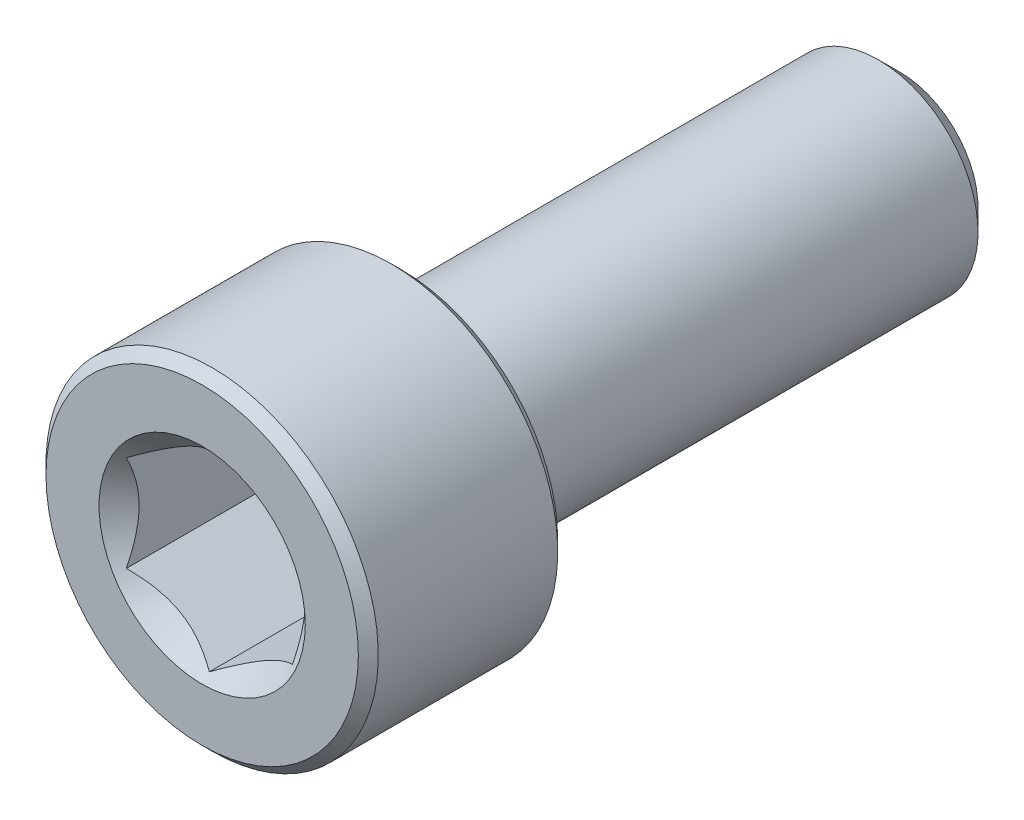
from build123d import *

# Parameters (mm, degrees)
CUT_EXTRUDE1_DEPTH = 5
SKETCH4_R          = 3.103257697
CUT_EXTRUDE2_DEPTH = 3
CUT_EXTRUDE2_DRAFT = -45


with BuildPart() as part:
    # Sketch2 → Revolve1 (revolve)
    with BuildSketch(Plane(origin=(0, 0, 0), x_dir=(0, 0, -1), z_dir=(1, 0, 0))):
        with BuildLine():
            Line((-10.5, 0), (-10.5, 4.7))
            Line((-10.5, 4.7), (-10.2, 5))
            Line((-10.2, 5), (-4.8, 5))
            Line((-4.8, 5), (-4.5, 4.7))
            Line((-4.5, 4.7), (-4.5, 3.3))
            ThreePointArc((-4.5, 3.3), (-4.412132034, 3.087867966), (-4.2, 3))
            Line((-4.2, 3), (9.850480947, 3))
            Line((9.850480947, 3), (10.5, 2.350480947))
            Line((10.5, 2.350480947), (10.5, 0))
            Line((10.5, 0), (-10.5, 0))
        make_face()
    revolve(axis=Axis((0, 0, -10.5), (0, 0, 1)))

    # Sketch3 → Cut-Extrude1 (cut)
    with BuildSketch(Plane.XY.offset(10.5)):
        Polygon((2.5, -1.443375673), (2.5, 1.443375673), (0, 2.886751346), (-2.5, 1.443375673), (-2.5, -1.443375673), (0, -2.886751346), align=None)
    extrude(amount=-CUT_EXTRUDE1_DEPTH, mode=Mode.SUBTRACT)


with BuildPart() as cut_extrude2_tool:
    # Sketch4 → Cut-Extrude2 (with draft: the straight prism first)
    with BuildSketch(Plane.XY.offset(10.5)):
        Circle(SKETCH4_R)
    extrude(amount=-CUT_EXTRUDE2_DEPTH)
    # Cut-Extrude2: the draft: its side faces are tilted about the plane it starts from
    cut_extrude2_sides = [cut_extrude2_tool.faces().sort_by_distance(p)[0] for p in [
        (-3.103257697, 0, 9),
    ]]
    draft(cut_extrude2_sides, Plane.XY.offset(10.5), CUT_EXTRUDE2_DRAFT)


with BuildPart() as part_1:
    add(part.part)

    # Cut-Extrude2: cut by cut_extrude2_tool
    add(cut_extrude2_tool.part, mode=Mode.SUBTRACT)


solid = part_1.part
